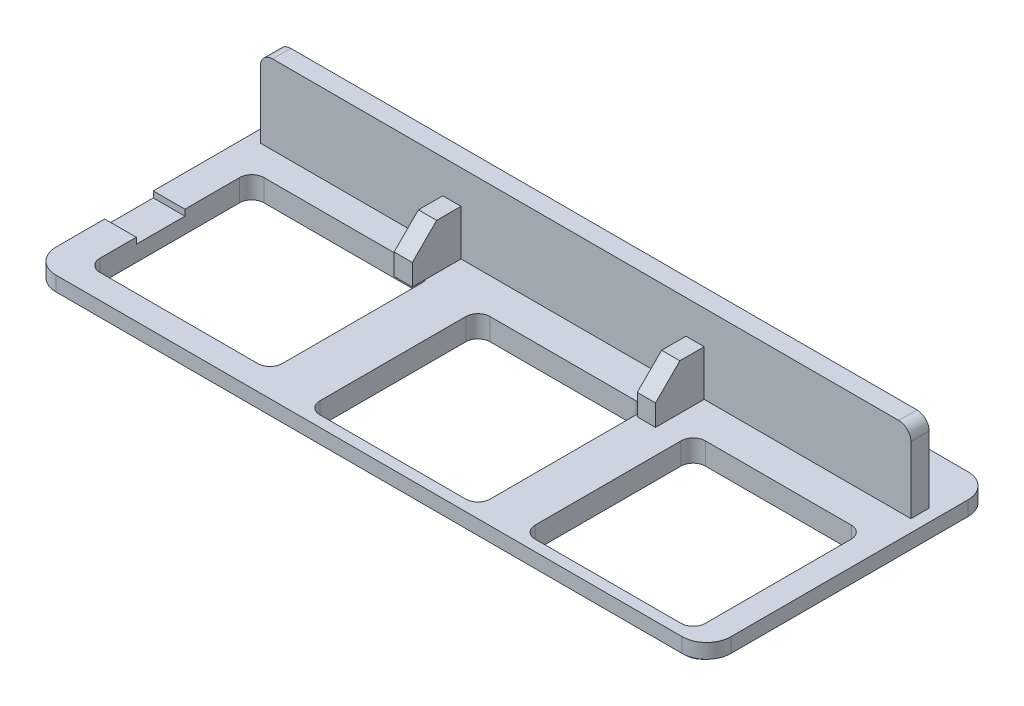
from build123d import *

# Parameters (mm, degrees)
SKETCH_1_W          = 55.5
SKETCH_1_H          = 23.5
EXTRUDE_1_DEPTH     = 1.2
FILLET_1_R          = 2
SKETCH_2_W          = 53.7
SKETCH_2_H          = 22.3
EXTRUDE_2_DEPTH     = 0.6
SKETCH_3_W          = 15
SKETCH_3_H          = 13.5
SKETCH_3_W_2        = 14
SKETCH_3_H_2        = 14
CUT_EXTRUDE_1_DEPTH = 3
FILLET_2_R          = 1
SKETCH_4_W          = 15.5
SKETCH_4_H          = 3.997435945
CUT_EXTRUDE_2_DEPTH = 0.5
SKETCH_5_W          = 53.5
SKETCH_5_H          = 1.5
EXTRUDE_3_DEPTH     = 6.5
FILLET_3_R          = 1
SKETCH_6_W          = 1.5
SKETCH_6_H          = 4
EXTRUDE_4_DEPTH     = 3.75
CHAMFER_1_SIZE      = 2
FILLET_4_R          = 1.5


with BuildPart() as part:
    # 草图1 → 凸台-拉伸1 (new body)
    with BuildSketch(Plane(origin=(0, 0, 0), x_dir=(1, 0, 0), z_dir=(0, 1, 0))):
        Rectangle(SKETCH_1_W, SKETCH_1_H)
    extrude(amount=EXTRUDE_1_DEPTH)

    # 圆角1
    fillet_1_edges = [part.edges().sort_by_distance(p)[0] for p in [
        (27.75, 0.6, 11.75),
        (-27.75, 0.6, 11.75),
        (-27.75, 0.6, -11.75),
        (27.75, 0.6, -11.75),
    ]]
    fillet(fillet_1_edges, radius=FILLET_1_R)

    # 草图2 → 凸台-拉伸2 (add)
    with BuildSketch(Plane.XZ):
        Rectangle(SKETCH_2_W, SKETCH_2_H)
    extrude(amount=EXTRUDE_2_DEPTH)

    # 草图3 → 切除-拉伸1 (cut)
    with BuildSketch(Plane.XZ.offset(0.6)):
        with Locations((-17.65, 3)):
            Rectangle(SKETCH_3_W, SKETCH_3_H)
        with Locations((1.05, 3.85)):
            Rectangle(SKETCH_3_W_2, SKETCH_3_H_2)
        with Locations((18.75, 3.85)):
            Rectangle(SKETCH_3_W_2, SKETCH_3_H_2)
    extrude(amount=-CUT_EXTRUDE_1_DEPTH, mode=Mode.SUBTRACT)

    # 圆角2
    fillet_2_edges = [part.edges().sort_by_distance(p)[0] for p in [
        (-25.15, 0.3, -3.75),
        (-25.15, 0.3, 9.75),
        (-10.15, 0.3, 9.75),
        (-10.15, 0.3, -3.75),
        (-5.95, 0.3, -3.15),
        (-5.95, 0.3, 10.85),
        (8.05, 0.3, 10.85),
        (8.05, 0.3, -3.15),
        (11.75, 0.3, -3.15),
        (11.75, 0.3, 10.85),
        (25.75, 0.3, 10.85),
        (25.75, 0.3, -3.15),
    ]]
    fillet(fillet_2_edges, radius=FILLET_2_R)

    # 草图4 → 切除-拉伸2 (cut)
    with BuildSketch(Plane(origin=(0, 1.2, 0), x_dir=(1, 0, 0), z_dir=(0, 1, 0))):
        with Locations((-20, -3.751282028)):
            Rectangle(SKETCH_4_W, SKETCH_4_H)
    extrude(amount=-CUT_EXTRUDE_2_DEPTH, mode=Mode.SUBTRACT)

    # 草图5 → 凸台-拉伸3 (add)
    with BuildSketch(Plane(origin=(0, 1.2, 0), x_dir=(1, 0, 0), z_dir=(0, 1, 0))):
        with Locations((0, 6.804632487)):
            Rectangle(SKETCH_5_W, SKETCH_5_H)
    extrude(amount=EXTRUDE_3_DEPTH)

    # 圆角3
    fillet_3_edges = [part.edges().sort_by_distance(p)[0] for p in [
        (26.75, 7.7, -6.804632487),
        (-26.75, 7.7, -6.804632487),
    ]]
    fillet(fillet_3_edges, radius=FILLET_3_R)

    # 草图6 → 凸台-拉伸4 (add)
    with BuildSketch(Plane(origin=(0, 1.2, 0), x_dir=(1, 0, 0), z_dir=(0, 1, 0))):
        with Locations((9, 4.054632487)):
            Rectangle(SKETCH_6_W, SKETCH_6_H)
        with Locations((-11, 4.054632487)):
            Rectangle(SKETCH_6_W, SKETCH_6_H)
    extrude(amount=EXTRUDE_4_DEPTH)

    # 倒角1
    chamfer_1_edges = [part.edges().sort_by_distance(p)[0] for p in [
        (9, 4.95, -2.054632487),
        (-11, 4.95, -2.054632487),
    ]]
    chamfer(chamfer_1_edges, length=CHAMFER_1_SIZE)

    # 圆角4
    fillet_4_edges = [part.edges().sort_by_distance(p)[0] for p in [
        (-26.85, -0.3, 11.15),
        (-26.85, -0.3, -11.15),
        (26.85, -0.3, -11.15),
        (26.85, -0.3, 11.15),
    ]]
    fillet(fillet_4_edges, radius=FILLET_4_R)


solid = part.part
